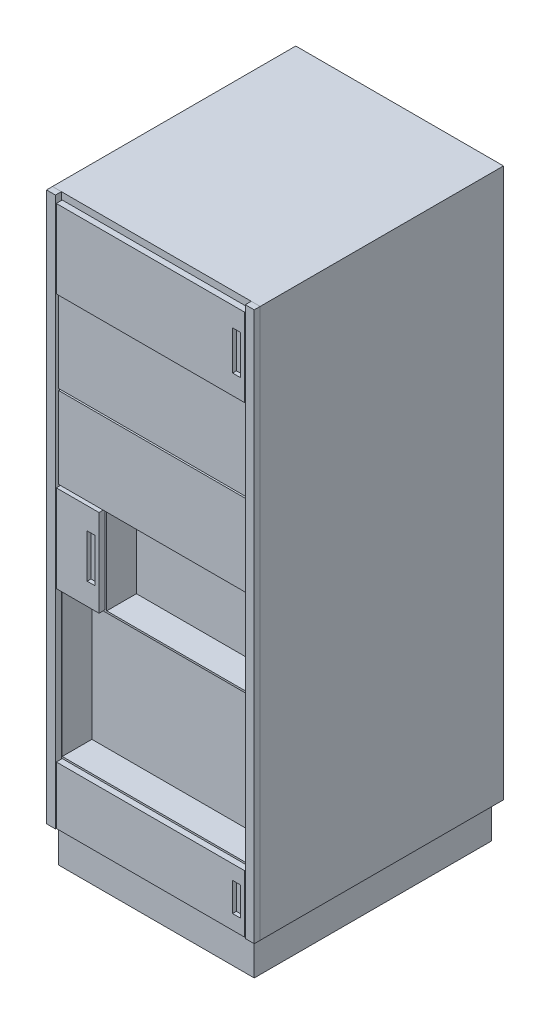
from build123d import *

# Parameters (mm, degrees)
SKETCH1_W                   = 700
SKETCH1_H                   = 1850
GOVDE_KASA_DEPTH            = 820
SKETCH2_W                   = 660
SKETCH2_H                   = 120
PLINT_DEPTH                 = 800
SKETCH3_W                   = 30
SKETCH3_H                   = 1850
SOVE_SOL_DEPTH              = 20
SKETCH4_W                   = 30
SKETCH4_H                   = 1850
SOVE_SAG_DEPTH              = 20
SKETCH5_W                   = 634
SKETCH5_H                   = 264
KAPAK_FAN_FILTRE_DEPTH      = 20
KAPAK_FAN_FILTRE_KULP_START = 7
SKETCH6_W                   = 26
SKETCH6_H                   = 132
KAPAK_FAN_FILTRE_KULP_DEPTH = 13
SKETCH7_W                   = 634
SKETCH7_H                   = 274
FIRIN_KAPAK_2_CAM_DEPTH     = 12
SKETCH8_W                   = 634
SKETCH8_H                   = 274
FIRIN_KAPAK_1_CAM_DEPTH     = 12
SKETCH9_W                   = 144
SKETCH9_H                   = 294
KAPAK_YAG_KABI_DEPTH        = 20
KAPAK_YAG_KABI_KULP_START   = 7
SKETCH10_W                  = 26
SKETCH10_H                  = 147
KAPAK_YAG_KABI_KULP_DEPTH   = 13
SKETCH11_W                  = 484
SKETCH11_H                  = 294
ACIKLIK_SPREY_DEPTH         = 100
SKETCH12_W                  = 634
SKETCH12_H                  = 494
ACIKLIK_KESME_DEPTH         = 100
SKETCH13_W                  = 634
SKETCH13_H                  = 194
KAPAK_PANO_DEPTH            = 20
KAPAK_PANO_KULP_START       = 7
SKETCH14_W                  = 26
SKETCH14_H                  = 97
KAPAK_PANO_KULP_DEPTH       = 13


with BuildPart() as part:
    # Sketch1 → govde_kasa (new body)
    with BuildSketch(Plane.XY):
        with Locations((350, 1045)):
            Rectangle(SKETCH1_W, SKETCH1_H)
    extrude(amount=-GOVDE_KASA_DEPTH)

    # Sketch11 → aciklik_sprey (cut)
    with BuildSketch(Plane.XY):
        with Locations((425, 970)):
            Rectangle(SKETCH11_W, SKETCH11_H)
    extrude(amount=-ACIKLIK_SPREY_DEPTH, mode=Mode.SUBTRACT)

    # Sketch12 → aciklik_kesme (cut)
    with BuildSketch(Plane.XY):
        with Locations((350, 570)):
            Rectangle(SKETCH12_W, SKETCH12_H)
    extrude(amount=-ACIKLIK_KESME_DEPTH, mode=Mode.SUBTRACT)


with BuildPart() as body_2:
    # Sketch2 → plint (new body)
    with BuildSketch(Plane.XY):
        with Locations((350, 60)):
            Rectangle(SKETCH2_W, SKETCH2_H)
    extrude(amount=-PLINT_DEPTH)


with BuildPart() as body_3:
    # Sketch3 → sove_sol (new body)
    with BuildSketch(Plane.XY):
        with Locations((15, 1045)):
            Rectangle(SKETCH3_W, SKETCH3_H)
    extrude(amount=SOVE_SOL_DEPTH)


with BuildPart() as body_4:
    # Sketch4 → sove_sag (new body)
    with BuildSketch(Plane.XY):
        with Locations((685, 1045)):
            Rectangle(SKETCH4_W, SKETCH4_H)
    extrude(amount=SOVE_SAG_DEPTH)


with BuildPart() as body_5:
    # Sketch5 → kapak_fan_filtre (new body)
    with BuildSketch(Plane.XY):
        with Locations((350, 1815)):
            Rectangle(SKETCH5_W, SKETCH5_H)
    extrude(amount=KAPAK_FAN_FILTRE_DEPTH)

    # Sketch6 → kapak_fan_filtre_kulp (cut)
    with BuildSketch(Plane.XY.offset(KAPAK_FAN_FILTRE_KULP_START)):
        with Locations((640, 1815)):
            Rectangle(SKETCH6_W, SKETCH6_H)
    extrude(amount=KAPAK_FAN_FILTRE_KULP_DEPTH, mode=Mode.SUBTRACT)


with BuildPart() as body_6:
    # Sketch7 → firin_kapak_2_cam (new body)
    with BuildSketch(Plane.XY):
        with Locations((350, 1540)):
            Rectangle(SKETCH7_W, SKETCH7_H)
    extrude(amount=FIRIN_KAPAK_2_CAM_DEPTH)


with BuildPart() as body_7:
    # Sketch8 → firin_kapak_1_cam (new body)
    with BuildSketch(Plane.XY):
        with Locations((350, 1260)):
            Rectangle(SKETCH8_W, SKETCH8_H)
    extrude(amount=FIRIN_KAPAK_1_CAM_DEPTH)


with BuildPart() as body_8:
    # Sketch9 → kapak_yag_kabi (new body)
    with BuildSketch(Plane.XY):
        with Locations((105, 970)):
            Rectangle(SKETCH9_W, SKETCH9_H)
    extrude(amount=KAPAK_YAG_KABI_DEPTH)

    # Sketch10 → kapak_yag_kabi_kulp (cut)
    with BuildSketch(Plane.XY.offset(KAPAK_YAG_KABI_KULP_START)):
        with Locations((150, 970)):
            Rectangle(SKETCH10_W, SKETCH10_H)
    extrude(amount=KAPAK_YAG_KABI_KULP_DEPTH, mode=Mode.SUBTRACT)


with BuildPart() as body_9:
    # Sketch13 → kapak_pano (new body)
    with BuildSketch(Plane.XY):
        with Locations((350, 220)):
            Rectangle(SKETCH13_W, SKETCH13_H)
    extrude(amount=KAPAK_PANO_DEPTH)

    # Sketch14 → kapak_pano_kulp (cut)
    with BuildSketch(Plane.XY.offset(KAPAK_PANO_KULP_START)):
        with Locations((640, 220)):
            Rectangle(SKETCH14_W, SKETCH14_H)
    extrude(amount=KAPAK_PANO_KULP_DEPTH, mode=Mode.SUBTRACT)


solid = Compound([part.part, body_2.part, body_3.part, body_4.part, body_5.part, body_6.part, body_7.part, body_8.part, body_9.part])
